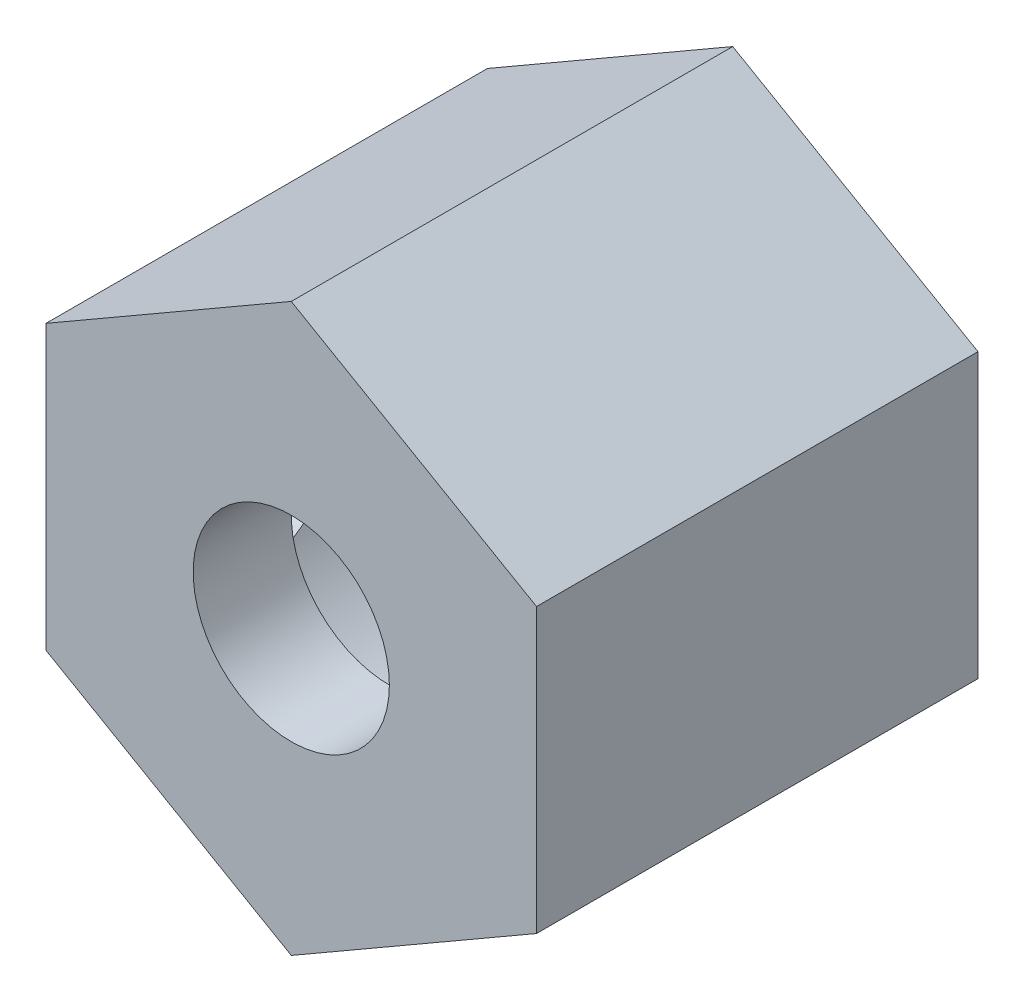
from build123d import *

# Parameters (mm, degrees)
BOSS_EXTRUDE1_DEPTH = 6
SKETCH3_R           = 2
CUT_EXTRUDE1_DEPTH  = 2.5
CUT_EXTRUDE5_REACH  = 11.713
SKETCH5_R           = 2
SKETCH6_R           = 2
BOSS_EXTRUDE2_DEPTH = 3
SKETCH7_R           = 4
CUT_EXTRUDE6_DEPTH  = 7


with BuildPart() as part:
    # Sketch2 → Boss-Extrude1 (new body)
    with BuildSketch(Plane.XY):
        Polygon((0, -5.773502692), (5, -2.886751346), (5, 2.886751346), (0, 5.773502692), (-5, 2.886751346), (-5, -2.886751346), align=None)
    extrude(amount=BOSS_EXTRUDE1_DEPTH)

    # Sketch3 → Cut-Extrude1 (cut)
    with BuildSketch(Plane.ZY.offset(5)):
        with Locations(Location((3, 0, 0), (0, 0, 270))):
            Circle(SKETCH3_R)
    extrude(amount=-CUT_EXTRUDE1_DEPTH, mode=Mode.SUBTRACT)

    # Sketch5 → Cut-Extrude5 (cut, up to next)
    with BuildSketch(Plane.XY.offset(6), mode=Mode.PRIVATE) as cut_extrude5_sk1:
        Circle(SKETCH5_R)
    cut_extrude5_tool1 = extrude(cut_extrude5_sk1.sketch, amount=-CUT_EXTRUDE5_REACH, mode=Mode.PRIVATE) & part.part
    add(cut_extrude5_tool1.solids().sort_by_distance((0, 0, 6))[0], mode=Mode.SUBTRACT)

    # Sketch6 → Boss-Extrude2 (add)
    with BuildSketch(Plane(origin=(0, 0, 0), x_dir=(-1, 0, 0), z_dir=(0, 0, -1))):
        Polygon((0, 5.773502692), (-5, 2.886751346), (-5, -2.886751346), (0, -5.773502692), (5, -2.886751346), (5, 2.886751346), align=None)
        with Locations(Location((0, 0, 0), (0, 0, 180))):
            Circle(SKETCH6_R, mode=Mode.SUBTRACT)
    extrude(amount=BOSS_EXTRUDE2_DEPTH)

    # Sketch7 → Cut-Extrude6 (cut)
    with BuildSketch(Plane(origin=(0, 0, -3), x_dir=(-1, 0, 0), z_dir=(0, 0, -1))):
        Circle(SKETCH7_R)
    extrude(amount=-CUT_EXTRUDE6_DEPTH, mode=Mode.SUBTRACT)


solid = part.part
